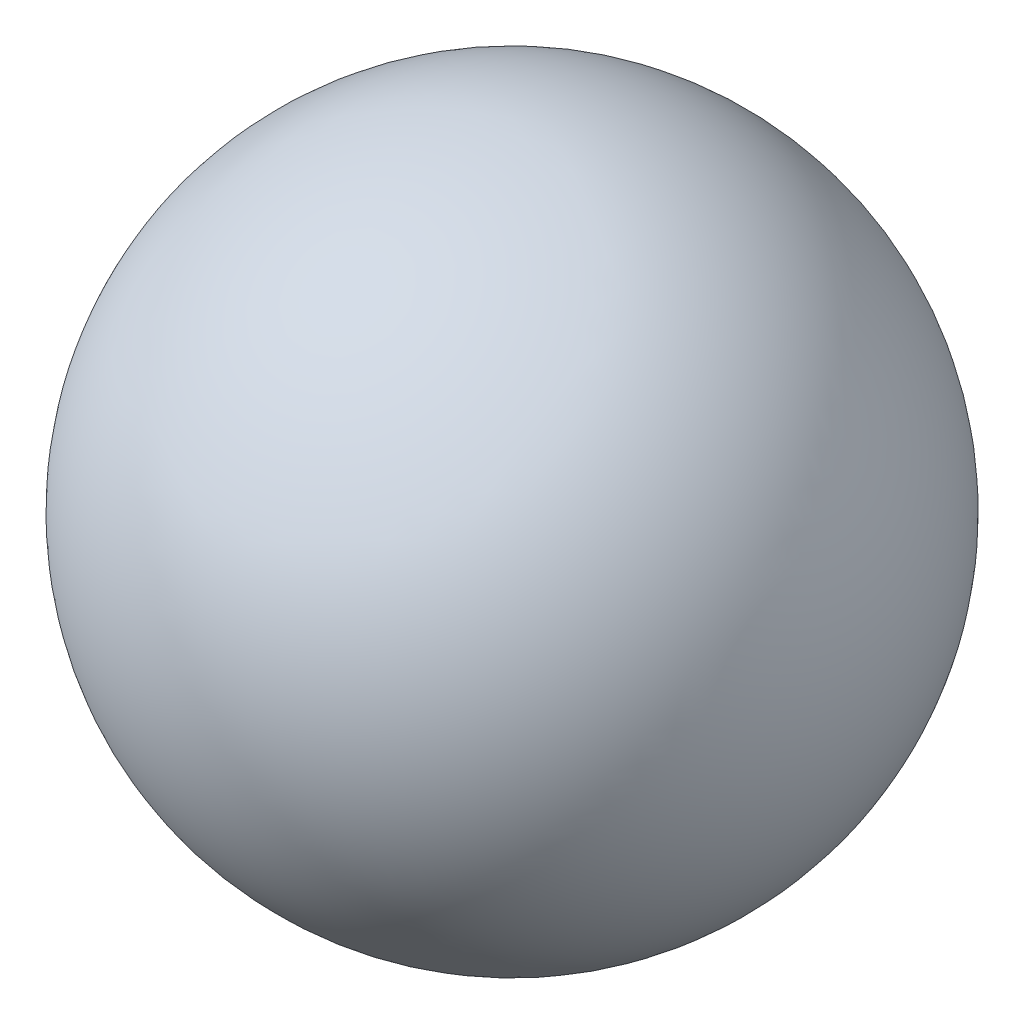
from build123d import *


with BuildPart() as part:
    # Esquisse1 → Base-Révolution (revolve)
    with BuildSketch(Plane.XY):
        with BuildLine():
            Line((-2.857142857, 12.5), (2.857142857, 12.5))
            ThreePointArc((2.857142857, 12.5), (0, 15.357142857), (-2.857142857, 12.5))
        make_face()
    revolve(axis=Axis((4.887863217, 12.5, 0), (-1, 0, 0)))


solid = part.part
